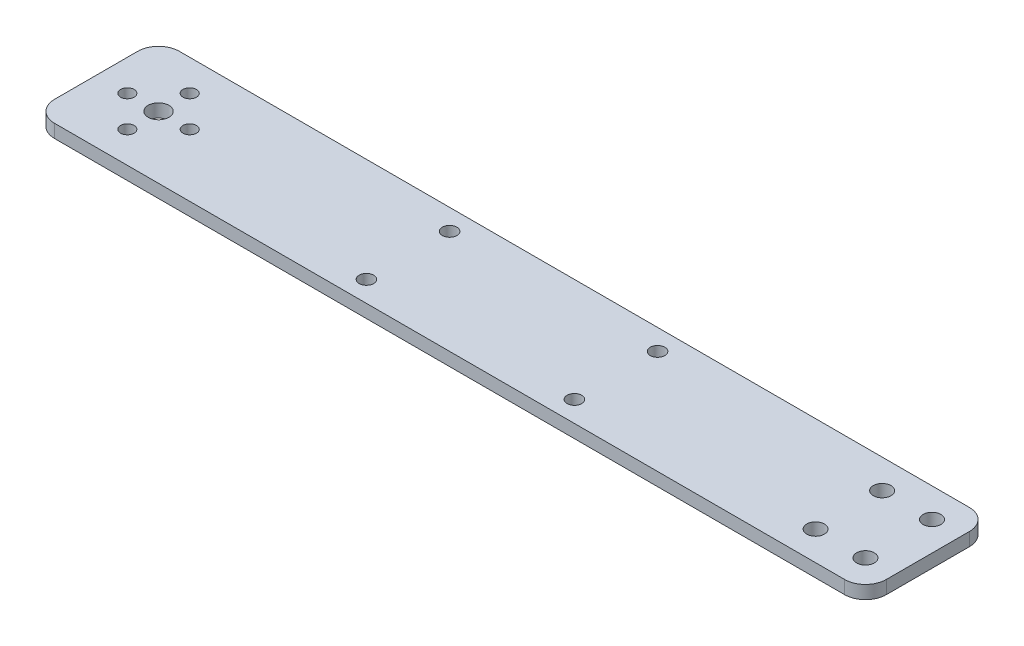
from build123d import *

# Parameters (mm, degrees)
SKETCH1_W           = 200
SKETCH1_H           = 30
BOSS_EXTRUDE1_DEPTH = 3.175
FILLET1_R           = 5
SKETCH2_R           = 2.5
CUT_EXTRUDE1_DEPTH  = 186.634265762
SKETCH3_R           = 1.625
CUT_EXTRUDE3_DEPTH  = 186.634265762
SKETCH4_R           = 1.75
CUT_EXTRUDE4_DEPTH  = 10
SKETCH5_R           = 2.125
CUT_EXTRUDE5_DEPTH  = 186.634265762


with BuildPart() as part:
    # Sketch1 → Boss-Extrude1 (new body)
    with BuildSketch(Plane(origin=(0, 0, 0), x_dir=(1, 0, 0), z_dir=(0, 1, 0))):
        with Locations((85, 0)):
            Rectangle(SKETCH1_W, SKETCH1_H)
    extrude(amount=BOSS_EXTRUDE1_DEPTH)

    # Fillet1
    fillet1_edges = [part.edges().sort_by_distance(p)[0] for p in [
        (-15, 1.5875, -15),
        (185, 1.5875, -15),
        (185, 1.5875, 15),
        (-15, 1.5875, 15),
    ]]
    fillet(fillet1_edges, radius=FILLET1_R)

    # Sketch2 → Cut-Extrude1 (cut, through all)
    with BuildSketch(Plane(origin=(0, 3.175, 0), x_dir=(1, 0, 0), z_dir=(0, 1, 0))):
        with Locations(Location((0, 0, 0), (0, 0, 270))):
            Circle(SKETCH2_R)
    extrude(amount=-CUT_EXTRUDE1_DEPTH, mode=Mode.SUBTRACT)

    # Sketch3 → Cut-Extrude3 (cut, through all)
    with BuildSketch(Plane(origin=(0, 3.175, 0), x_dir=(1, 0, 0), z_dir=(0, 1, 0))):
        with Locations(Location((7.5, 0, 0), (0, 0, 270))):
            Circle(SKETCH3_R)
        with Locations(Location((0, -7.5, 0), (0, 0, 270))):
            Circle(SKETCH3_R)
        with Locations(Location((-7.5, 0, 0), (0, 0, 270))):
            Circle(SKETCH3_R)
        with Locations(Location((0, 7.5, 0), (0, 0, 270))):
            Circle(SKETCH3_R)
    extrude(amount=-CUT_EXTRUDE3_DEPTH, mode=Mode.SUBTRACT)

    # Sketch4 → Cut-Extrude4 (cut)
    with BuildSketch(Plane(origin=(0, 3.175, 0), x_dir=(1, 0, 0), z_dir=(0, 1, 0))):
        with Locations(Location((60, -10, 0), (0, 0, 270))):
            Circle(SKETCH4_R)
        with Locations(Location((110, -10, 0), (0, 0, 270))):
            Circle(SKETCH4_R)
        with Locations(Location((110, 10, 0), (0, 0, 270))):
            Circle(SKETCH4_R)
        with Locations(Location((60, 10, 0), (0, 0, 270))):
            Circle(SKETCH4_R)
    extrude(amount=-CUT_EXTRUDE4_DEPTH, mode=Mode.SUBTRACT)

    # Sketch5 → Cut-Extrude5 (cut, through all)
    with BuildSketch(Plane(origin=(0, 3.175, 0), x_dir=(1, 0, 0), z_dir=(0, 1, 0))):
        with Locations(Location((166, 8, 0), (0, 0, 270))):
            Circle(SKETCH5_R)
        with Locations(Location((178, 8, 0), (0, 0, 90))):
            Circle(SKETCH5_R)
        with Locations(Location((178, -8, 0), (0, 0, 270))):
            Circle(SKETCH5_R)
        with Locations(Location((166, -8, 0), (0, 0, 90))):
            Circle(SKETCH5_R)
    extrude(amount=-CUT_EXTRUDE5_DEPTH, mode=Mode.SUBTRACT)


solid = part.part
